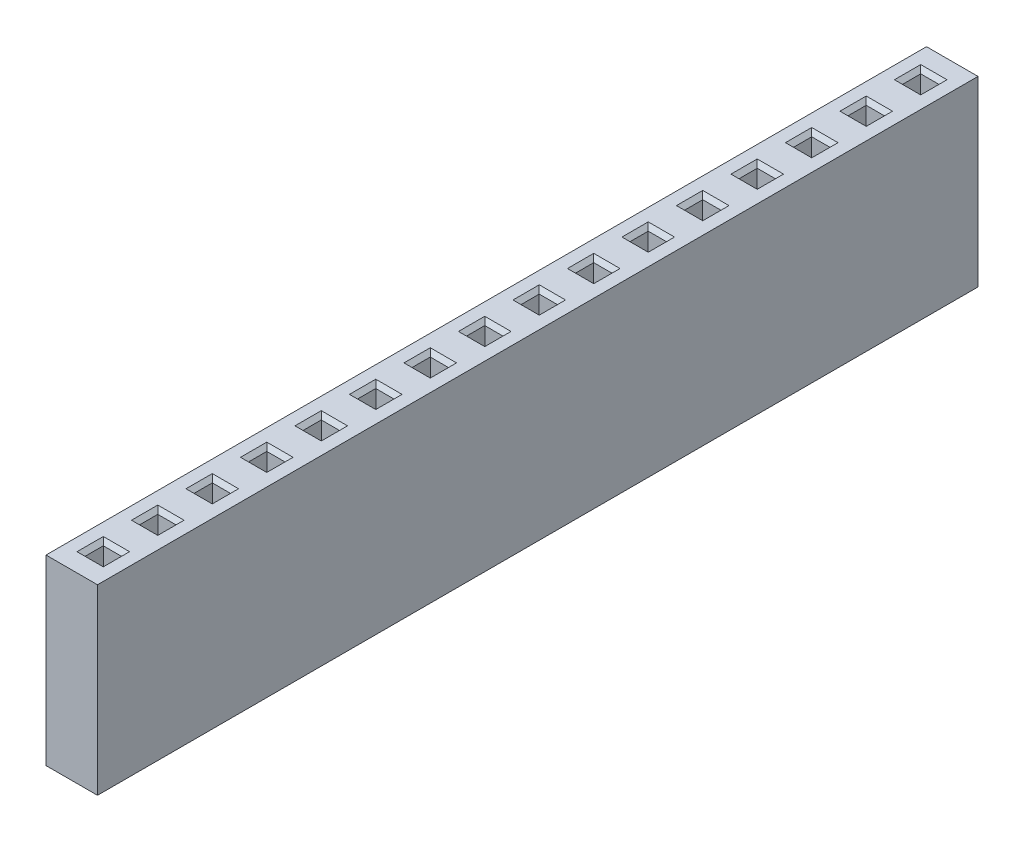
from build123d import *

# Parameters (mm, degrees)
SKETCH1_W                  = 41.04
SKETCH1_H                  = 8.5
BOSS_EXTRUDE1_DEPTH        = 2.4
SKETCH3_W                  = 0.85
SKETCH3_H                  = 0.85
CUT_EXTRUDE2_DEPTH         = 23.34010743
CHAMFER1_SIZE              = 0.1875
LPATTERN2_COUNT            = 16
LPATTERN2_PITCH            = 2.54
CHAMFER1_OF_LPATTERN2_SIZE = 0.1875


with BuildPart() as part:
    # Sketch1 → Boss-Extrude1 (new body)
    with BuildSketch(Plane(origin=(0, 0, 0), x_dir=(0, 0, -1), z_dir=(1, 0, 0))):
        Rectangle(SKETCH1_W, SKETCH1_H)
    extrude(amount=BOSS_EXTRUDE1_DEPTH)

    # Sketch3 → Cut-Extrude2 (cut, through all)
    with BuildSketch(Plane(origin=(0, 4.25, 0), x_dir=(1, 0, 0), z_dir=(0, 1, 0))):
        with Locations((1.2, -19.05)):
            Rectangle(SKETCH3_W, SKETCH3_H)
    cut_extrude2 = extrude(amount=-CUT_EXTRUDE2_DEPTH, mode=Mode.SUBTRACT)

    # Chamfer1
    chamfer1_edges = [part.edges().sort_by_distance(p)[0] for p in [
        (1.2, 4.25, 18.625),
        (0.775, 4.25, 19.05),
        (1.2, 4.25, 19.475),
        (1.625, 4.25, 19.05),
    ]]
    chamfer(chamfer1_edges, length=CHAMFER1_SIZE)

    # LPattern2: Cut-Extrude2 ×16
    with Locations(*[(0, 0, -i * LPATTERN2_PITCH) for i in range(1, LPATTERN2_COUNT)]):
        add(cut_extrude2, mode=Mode.SUBTRACT)

    # Chamfer1 of LPattern2
    chamfer1_of_lpattern2_edges = [part.edges().sort_by_distance(p)[0] for p in [
        (1.2, 4.25, 16.085),
        (0.775, 4.25, 16.51),
        (1.2, 4.25, 16.935),
        (1.625, 4.25, 16.51),
        (1.2, 4.25, 13.545),
        (0.775, 4.25, 13.97),
        (1.2, 4.25, 14.395),
        (1.625, 4.25, 13.97),
        (1.2, 4.25, 11.005),
        (0.775, 4.25, 11.43),
        (1.2, 4.25, 11.855),
        (1.625, 4.25, 11.43),
        (1.2, 4.25, 8.465),
        (0.775, 4.25, 8.89),
        (1.2, 4.25, 9.315),
        (1.625, 4.25, 8.89),
        (1.2, 4.25, 5.925),
        (0.775, 4.25, 6.35),
        (1.2, 4.25, 6.775),
        (1.625, 4.25, 6.35),
        (1.2, 4.25, 3.385),
        (0.775, 4.25, 3.81),
        (1.2, 4.25, 4.235),
        (1.625, 4.25, 3.81),
        (1.2, 4.25, 0.845),
        (0.775, 4.25, 1.27),
        (1.2, 4.25, 1.695),
        (1.625, 4.25, 1.27),
        (1.2, 4.25, -1.695),
        (0.775, 4.25, -1.27),
        (1.2, 4.25, -0.845),
        (1.625, 4.25, -1.27),
        (1.2, 4.25, -4.235),
        (0.775, 4.25, -3.81),
        (1.2, 4.25, -3.385),
        (1.625, 4.25, -3.81),
        (1.2, 4.25, -6.775),
        (0.775, 4.25, -6.35),
        (1.2, 4.25, -5.925),
        (1.625, 4.25, -6.35),
        (1.2, 4.25, -9.315),
        (0.775, 4.25, -8.89),
        (1.2, 4.25, -8.465),
        (1.625, 4.25, -8.89),
        (1.2, 4.25, -11.855),
        (0.775, 4.25, -11.43),
        (1.2, 4.25, -11.005),
        (1.625, 4.25, -11.43),
        (1.2, 4.25, -14.395),
        (0.775, 4.25, -13.97),
        (1.2, 4.25, -13.545),
        (1.625, 4.25, -13.97),
        (1.2, 4.25, -16.935),
        (0.775, 4.25, -16.51),
        (1.2, 4.25, -16.085),
        (1.625, 4.25, -16.51),
        (1.2, 4.25, -19.475),
        (0.775, 4.25, -19.05),
        (1.2, 4.25, -18.625),
        (1.625, 4.25, -19.05),
    ]]
    chamfer(chamfer1_of_lpattern2_edges, length=CHAMFER1_OF_LPATTERN2_SIZE)


solid = part.part
